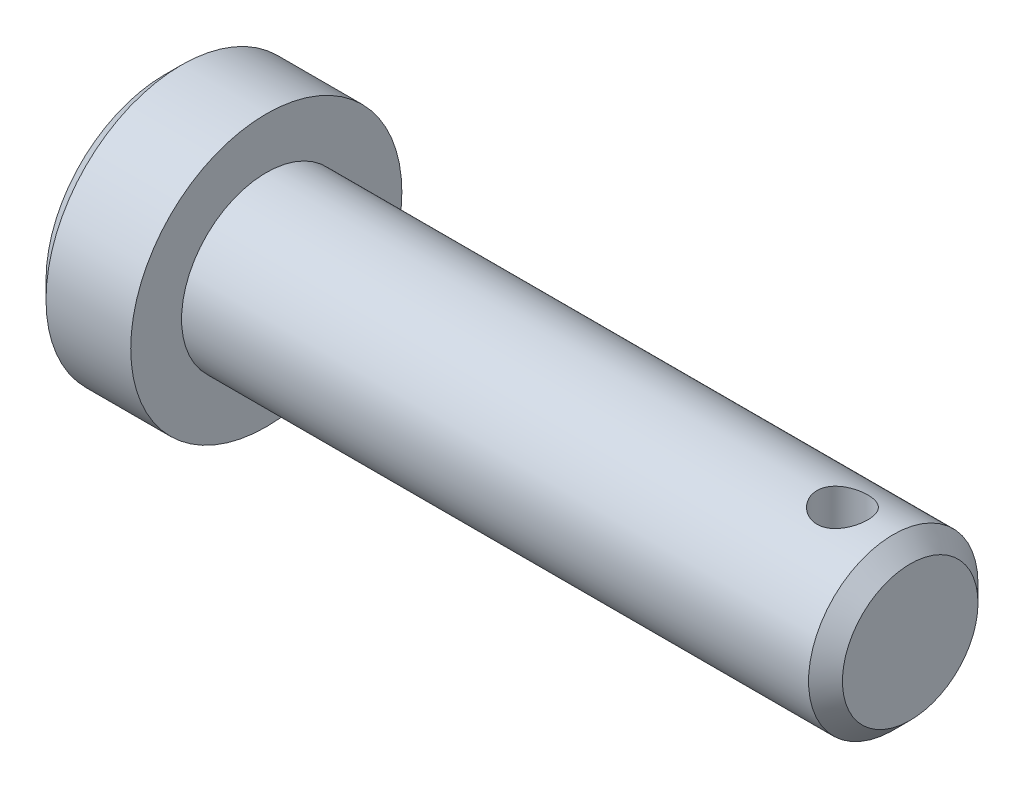
from build123d import *

# Parameters (mm, degrees)
CHAMFER_1_SIZE           = 1
CHAMFER_2_SIZE           = 1
CUT_EXTRUDE_2_DEPTH      = 29.599611497
CUT_EXTRUDE_2_DEPTH_BACK = 29.599611497
SKETCH_2_R               = 1.5


with BuildPart() as part:
    # 草图1 → 旋转1 (revolve)
    with BuildSketch(Plane.XY, mode=Mode.PRIVATE) as revolve_1_sk:
        Polygon((-26.266666667, 0), (-26.266666667, 8), (-20.266666667, 8), (-20.266666667, 5), (17.733333333, 5), (17.733333333, 0), align=None)
    revolve(revolve_1_sk.sketch.rotate(Axis((0, 0, 0), (-1, 0, 0)), 90), axis=Axis((0, 0, 0), (-1, 0, 0)))

    # 倒角1
    chamfer_1_edges = [part.edges().sort_by_distance(p)[0] for p in [
        (17.733333333, 0, 5),
    ]]
    chamfer(chamfer_1_edges, length=CHAMFER_1_SIZE)

    # 倒角2
    chamfer_2_edges = [part.edges().sort_by_distance(p)[0] for p in [
        (-26.266666667, 0, 8),
    ]]
    chamfer(chamfer_2_edges, length=CHAMFER_2_SIZE)

    # 草图2 → 切除-拉伸2 (cut, two sides: drawn at the far end of the back side and taken through both)
    with BuildSketch(Plane(origin=(0, 0, 0), x_dir=(1, 0, 0), z_dir=(0, 1, 0)).offset(-CUT_EXTRUDE_2_DEPTH_BACK)):
        with Locations(Location((13.733333333, 0, 0), (0, 0, 270))):
            Circle(SKETCH_2_R)
    extrude(amount=CUT_EXTRUDE_2_DEPTH + CUT_EXTRUDE_2_DEPTH_BACK, mode=Mode.SUBTRACT)


solid = part.part
